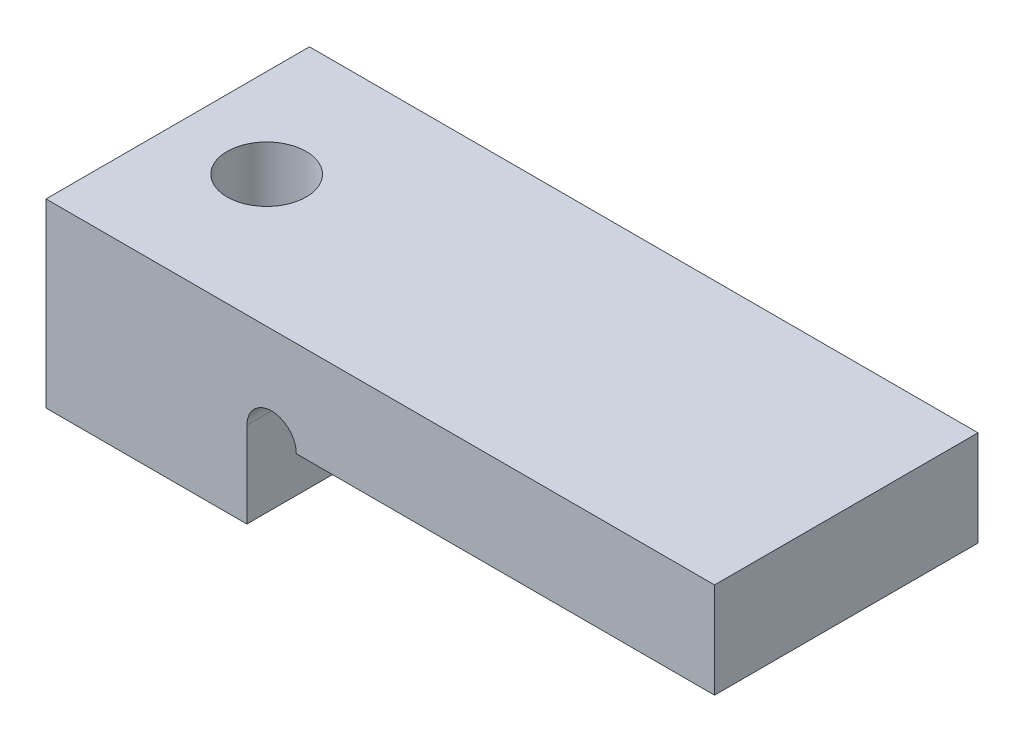
from build123d import *

# Parameters (mm, degrees)
BOSS_EXTRUDE2_DEPTH     = 4
CUT_EXTRUDE2_DEPTH      = 22.408876664
CUT_EXTRUDE2_DEPTH_BACK = 22.408876664
SKETCH2_R               = 1.2
CUT_EXTRUDE3_DEPTH      = 22.408876664
CUT_EXTRUDE3_DEPTH_BACK = 22.408876664
SKETCH3_R               = 0.75


with BuildPart() as part:
    # Sketch1 → Boss-Extrude2 (new, symmetric)
    with BuildSketch(Plane.XY):
        Polygon((0, 0), (6.1, 0), (6.1, 2.6), (20.3, 2.6), (20.3, 5.5), (0, 5.5), align=None)
    extrude(amount=BOSS_EXTRUDE2_DEPTH, both=True)

    # Sketch2 → Cut-Extrude2 (cut, two sides: drawn at the far end of the back side and taken through both)
    with BuildSketch(Plane(origin=(0, 0, 0), x_dir=(1, 0, 0), z_dir=(0, 1, 0)).offset(-CUT_EXTRUDE2_DEPTH_BACK)):
        with Locations(Location((2.7, 0, 0), (0, 0, 270))):
            Circle(SKETCH2_R)
    extrude(amount=CUT_EXTRUDE2_DEPTH + CUT_EXTRUDE2_DEPTH_BACK, mode=Mode.SUBTRACT)

    # Sketch3 → Cut-Extrude3 (cut, two sides: drawn at the far end of the back side and taken through both)
    with BuildSketch(Plane.XY.offset(-CUT_EXTRUDE3_DEPTH_BACK)):
        with Locations((6.85, 2.6)):
            Circle(SKETCH3_R)
    extrude(amount=CUT_EXTRUDE3_DEPTH + CUT_EXTRUDE3_DEPTH_BACK, mode=Mode.SUBTRACT)


solid = part.part
